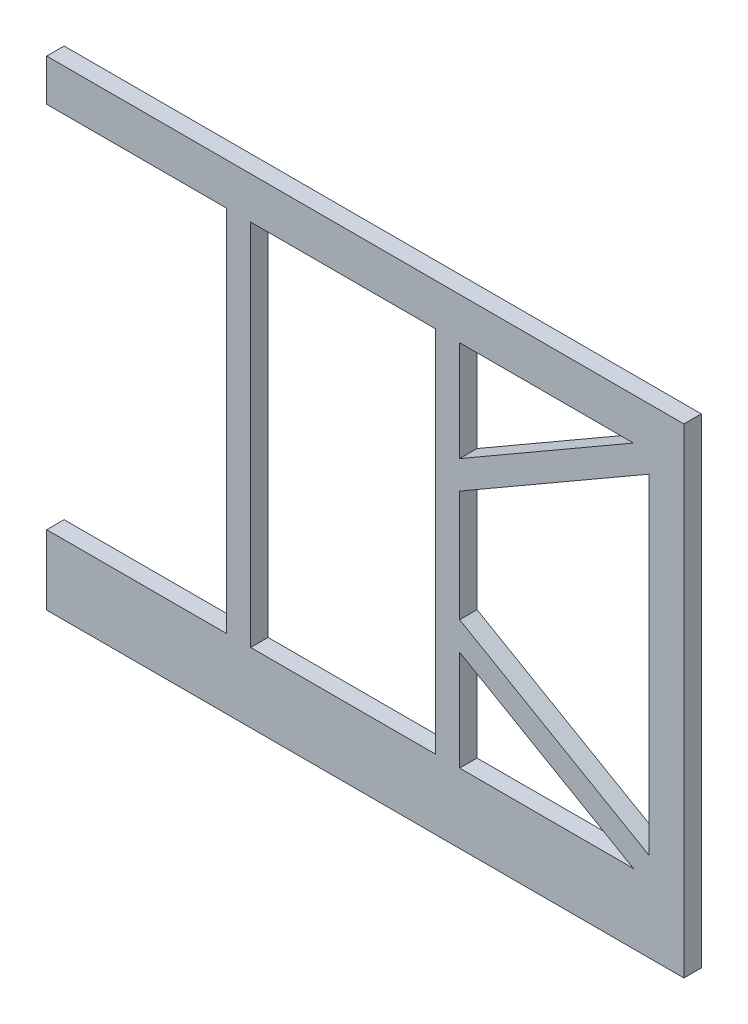
from build123d import *

# Parameters (mm, degrees)
SKETCH1_W           = 53
SKETCH1_H           = 105.8
BOSS_EXTRUDE1_DEPTH = 5


with BuildPart() as part:
    # Sketch1 → Boss-Extrude1 (new body)
    with BuildSketch(Plane.XY):
        Polygon((127.9, 63.9), (-55.082401894, 63.9), (-55.082401894, 51.9), (-3.5, 51.9), (-3.5, -53.9), (-55.082401894, -53.9), (-55.082401894, -73.9), (127.9, -73.9), (127.9, 51.9), align=None)
        with Locations((30, -1)):
            Rectangle(SKETCH1_W, SKETCH1_H, mode=Mode.SUBTRACT)
        Polygon((113.412674799, 51.9), (63.5, 51.9), (63.5, 23.082903769), align=None, mode=Mode.SUBTRACT)
        Polygon((113.412674799, -53.9), (63.5, -53.9), (63.5, -25.082903769), align=None, mode=Mode.SUBTRACT)
        Polygon((117.9, 46.407854644), (117.9, -48.407854644), (63.5, -17), (63.5, 15), align=None, mode=Mode.SUBTRACT)
    extrude(amount=BOSS_EXTRUDE1_DEPTH)


solid = part.part
